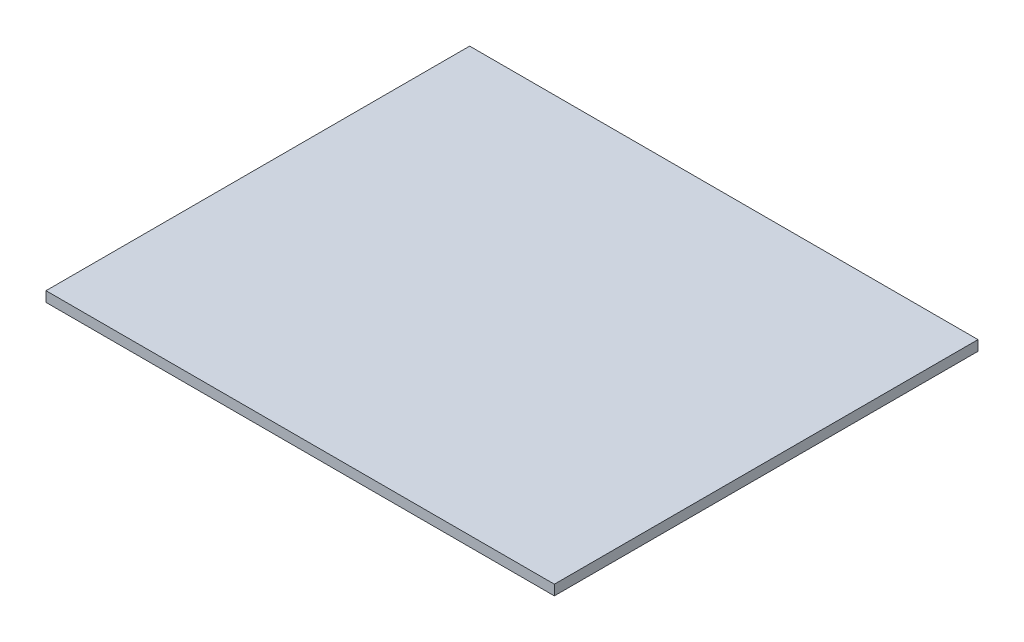
from build123d import *

# Parameters (mm, degrees)
SKETCH_1_W      = 900
SKETCH_1_H      = 750
EXTRUDE_1_DEPTH = 18


with BuildPart() as part:
    # 草图1 → 凸台-拉伸1 (new body)
    with BuildSketch(Plane(origin=(0, 0, 0), x_dir=(1, 0, 0), z_dir=(0, 1, 0))):
        with Locations((289.945280438, -99.213406293)):
            Rectangle(SKETCH_1_W, SKETCH_1_H)
    extrude(amount=EXTRUDE_1_DEPTH)


solid = part.part
